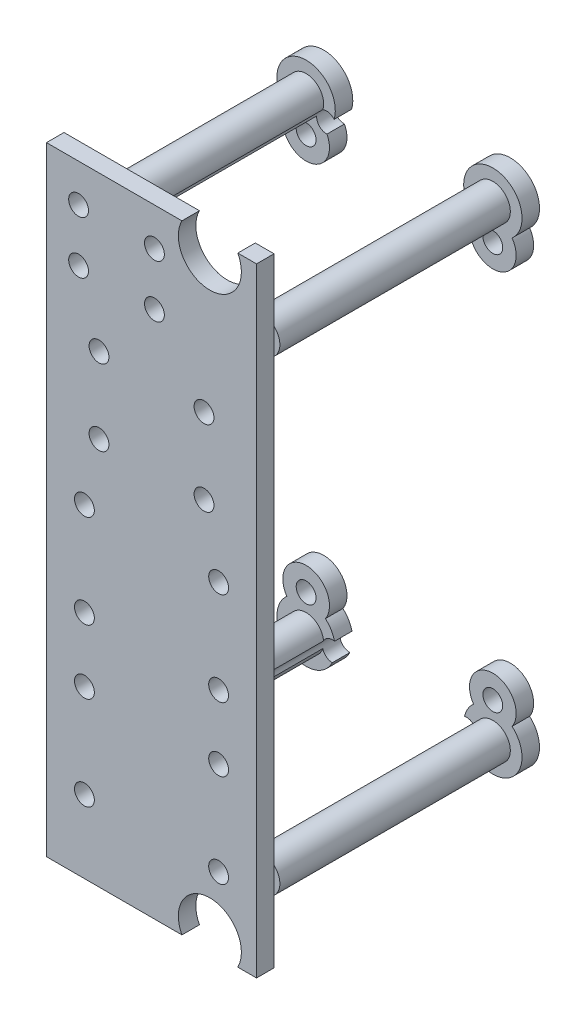
from build123d import *

# Parameters (mm, degrees)
MAIN_PROFILE_SKETCH_R     = 1.7
MAIN_EXTRUSION_DEPTH      = 3
DETAIL_PROFILE_2_SKETCH_R = 3
DETAIL_EXTRUSION_2_DEPTH  = 3.2
DETAIL_PROFILE_3_SKETCH_R = 3
DETAIL_EXTRUSION_3_DEPTH  = 36.3
DETAIL_PROFILE_4_SKETCH_R = 1.7
DETAIL_EXTRUSION_4_DEPTH  = 3


with BuildPart() as part:
    # Main Profile Sketch → Main Extrusion (new body)
    with BuildSketch(Plane.XY.offset(94)):
        with BuildLine():
            Line((182, 53), (205.213560822, 53))
            ThreePointArc((205.213560822, 53), (210, 45.1), (214.786439178, 53))
            Line((214.786439178, 53), (218, 53))
            Line((218, 53), (218, -53))
            Line((218, -53), (214.786439178, -53))
            ThreePointArc((214.786439178, -53), (210, -45.1), (205.213560822, -53))
            Line((205.213560822, -53), (182, -53))
            Line((182, -53), (182, 53))
        make_face()
        with Locations((188.5, -40.5)):
            Circle(MAIN_PROFILE_SKETCH_R, mode=Mode.SUBTRACT)
        with Locations((188.5, -24.5)):
            Circle(MAIN_PROFILE_SKETCH_R, mode=Mode.SUBTRACT)
        with Locations((188.5, -13.5)):
            Circle(MAIN_PROFILE_SKETCH_R, mode=Mode.SUBTRACT)
        with Locations((211.5, -40.5)):
            Circle(MAIN_PROFILE_SKETCH_R, mode=Mode.SUBTRACT)
        with Locations((211.5, -24.5)):
            Circle(MAIN_PROFILE_SKETCH_R, mode=Mode.SUBTRACT)
        with Locations((211.5, -13.5)):
            Circle(MAIN_PROFILE_SKETCH_R, mode=Mode.SUBTRACT)
        with Locations((188.5, 2.5)):
            Circle(MAIN_PROFILE_SKETCH_R, mode=Mode.SUBTRACT)
        with Locations((191, 13.5)):
            Circle(MAIN_PROFILE_SKETCH_R, mode=Mode.SUBTRACT)
        with Locations((187.5, 37.5)):
            Circle(MAIN_PROFILE_SKETCH_R, mode=Mode.SUBTRACT)
        with Locations((187.5, 46.5)):
            Circle(MAIN_PROFILE_SKETCH_R, mode=Mode.SUBTRACT)
        with Locations((191, 26.5)):
            Circle(MAIN_PROFILE_SKETCH_R, mode=Mode.SUBTRACT)
        with Locations((211.5, 2.5)):
            Circle(MAIN_PROFILE_SKETCH_R, mode=Mode.SUBTRACT)
        with Locations((209, 13.5)):
            Circle(MAIN_PROFILE_SKETCH_R, mode=Mode.SUBTRACT)
        with Locations((200.5, 37.5)):
            Circle(MAIN_PROFILE_SKETCH_R, mode=Mode.SUBTRACT)
        with Locations((200.5, 46.5)):
            Circle(MAIN_PROFILE_SKETCH_R, mode=Mode.SUBTRACT)
        with Locations((209, 26.5)):
            Circle(MAIN_PROFILE_SKETCH_R, mode=Mode.SUBTRACT)
    extrude(amount=-MAIN_EXTRUSION_DEPTH)

    # Detail Profile 2 Sketch → Detail Extrusion 2 (add)
    with BuildSketch(Plane.XY.offset(91)):
        with Locations((216, 40)):
            Circle(DETAIL_PROFILE_2_SKETCH_R)
        with BuildLine():
            ThreePointArc((186.879170519, 40.842838727), (184.733306198, 39.476209859), (184.136505156, 37.003107219))
            ThreePointArc((184.136505156, 37.003107219), (181.558799586, 41.743714581), (186.879170519, 40.842838727))
        make_face()
        with BuildLine():
            ThreePointArc((186.217803802, -37.979765782), (185.120795302, -40.124532811), (185.720244978, -42.457795194))
            ThreePointArc((185.720244978, -42.457795194), (181.018348796, -39.668705422), (186.217803802, -37.979765782))
        make_face()
        with BuildLine():
            ThreePointArc((214.279755022, -42.457795194), (214.879204698, -40.124532811), (213.782196198, -37.979765782))
            ThreePointArc((213.782196198, -37.979765782), (218.981651204, -39.668705422), (214.279755022, -42.457795194))
        make_face()
    extrude(amount=-DETAIL_EXTRUSION_2_DEPTH)

    # Detail Profile 3 Sketch → Detail Extrusion 3 (add)
    with BuildSketch(Plane.XY.offset(87.8)):
        with Locations((216, 40)):
            Circle(DETAIL_PROFILE_3_SKETCH_R)
        with BuildLine():
            ThreePointArc((186.852864262, 39.072009967), (186.116653099, 38.488104929), (185.803081684, 37.602314357))
            ThreePointArc((185.803081684, 37.602314357), (181.558799586, 41.743714581), (186.852864262, 39.072009967))
        make_face()
        with BuildLine():
            ThreePointArc((186.98730258, -39.724276779), (186.810397651, -40.312266406), (186.853916932, -40.924747611))
            ThreePointArc((186.853916932, -40.924747611), (181.018348796, -39.668705422), (186.98730258, -39.724276779))
        make_face()
        with BuildLine():
            ThreePointArc((213.146083068, -40.924747611), (213.189602349, -40.312266406), (213.01269742, -39.724276779))
            ThreePointArc((213.01269742, -39.724276779), (218.981651204, -39.668705422), (213.146083068, -40.924747611))
        make_face()
    extrude(amount=-DETAIL_EXTRUSION_3_DEPTH)

    # Detail Profile 4 Sketch → Detail Extrusion 4 (add)
    # profile 1 of 4: a face of its own
    with BuildSketch(Plane.XY.offset(51.5)):
        with BuildLine():
            ThreePointArc((188.799011897, 38.596616656), (185.943513385, 38.18362959), (187.571358812, 35.801498331))
            ThreePointArc((187.571358812, 35.801498331), (183.73974082, 30.008475835), (180.692810861, 36.25))
            ThreePointArc((180.692810861, 36.25), (182.609663272, 44.802807906), (188.799011897, 38.596616656))
        make_face()
        with Locations((184, 34)):
            Circle(DETAIL_PROFILE_4_SKETCH_R, mode=Mode.SUBTRACT)
    # profile 2 of 4: a face of its own
    with BuildSketch(Plane.XY.offset(51.5)):
        with BuildLine():
            ThreePointArc((188.863411368, -38.839297685), (186.810397651, -40.312266406), (188.490003266, -42.199970607))
            ThreePointArc((188.490003266, -42.199970607), (180.96680039, -43.974883662), (180.692810861, -36.25))
            ThreePointArc((180.692810861, -36.25), (184, -30), (187.307189139, -36.25))
            ThreePointArc((187.307189139, -36.25), (188.285533081, -37.424304713), (188.863411368, -38.839297685))
        make_face()
        with Locations((184, -34)):
            Circle(DETAIL_PROFILE_4_SKETCH_R, mode=Mode.SUBTRACT)
    # profile 3 of 4: a face of its own
    with BuildSketch(Plane.XY.offset(51.5)):
        with BuildLine():
            ThreePointArc((211.509996734, -42.199970607), (213.189602349, -40.312266406), (211.136588632, -38.839297685))
            ThreePointArc((211.136588632, -38.839297685), (211.714466919, -37.424304713), (212.692810861, -36.25))
            ThreePointArc((212.692810861, -36.25), (216, -30), (219.307189139, -36.25))
            ThreePointArc((219.307189139, -36.25), (219.03319961, -43.974883662), (211.509996734, -42.199970607))
        make_face()
        with Locations((216, -34)):
            Circle(DETAIL_PROFILE_4_SKETCH_R, mode=Mode.SUBTRACT)
    # profile 4 of 4: a face of its own
    with BuildSketch(Plane.XY.offset(51.5)):
        with BuildLine():
            ThreePointArc((212.692810861, 36.25), (216, 30), (219.307189139, 36.25))
            ThreePointArc((219.307189139, 36.25), (216, 45), (212.692810861, 36.25))
        make_face()
        with Locations((216, 34)):
            Circle(DETAIL_PROFILE_4_SKETCH_R, mode=Mode.SUBTRACT)
    extrude(amount=-DETAIL_EXTRUSION_4_DEPTH)


solid = part.part
